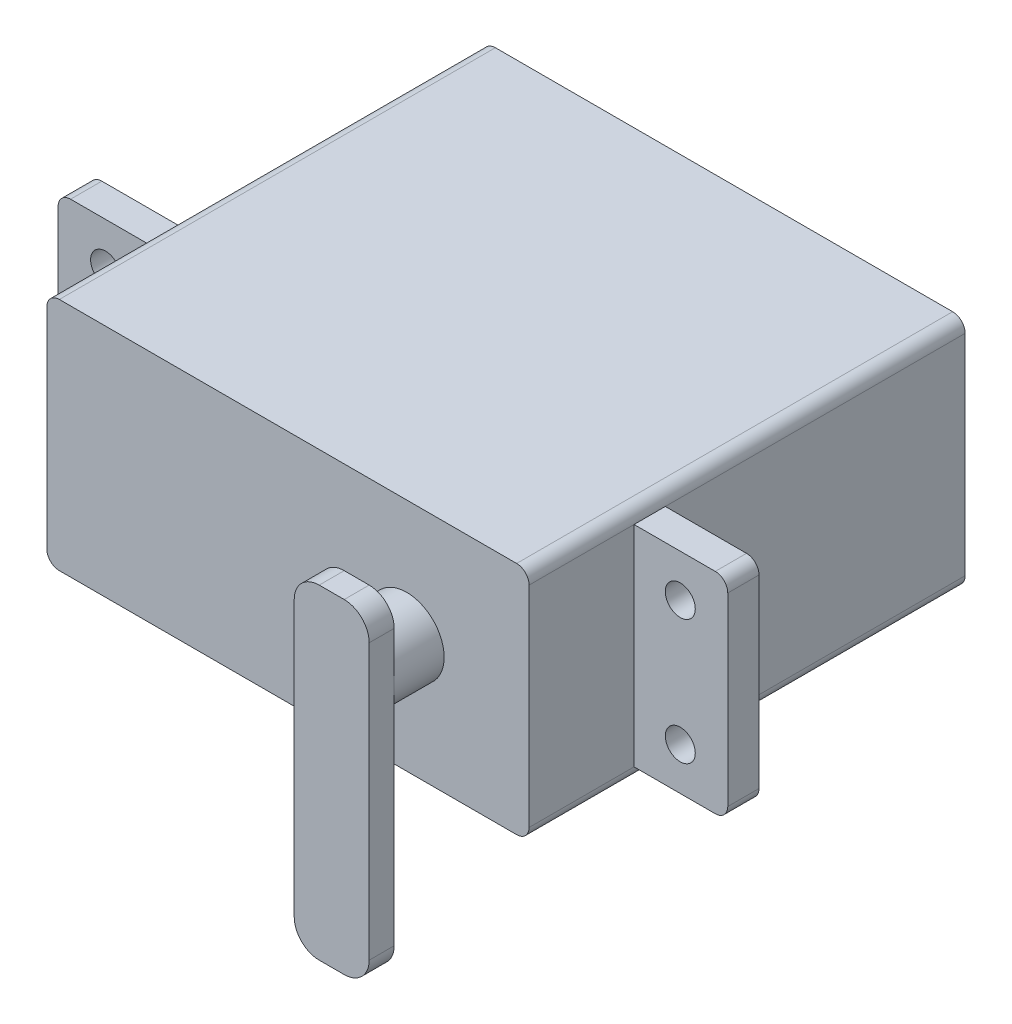
from build123d import *

# Parameters (mm, degrees)
BOSS_EXTRUDE1_DEPTH = 34.9
BOSS_EXTRUDE2_DEPTH = 2.5
SKETCH3_R           = 1.2
CUT_EXTRUDE1_DEPTH  = 2.5
SKETCH4_R           = 3
BOSS_EXTRUDE3_DEPTH = 4
BOSS_EXTRUDE4_DEPTH = 2


with BuildPart() as part:
    # Sketch1 → Boss-Extrude1 (new body)
    with BuildSketch(Plane.XY):
        with BuildLine():
            Line((-18.3, -9.4), (18.3, -9.4))
            ThreePointArc((18.3, -9.4), (19.007106781, -9.107106781), (19.3, -8.4))
            Line((19.3, -8.4), (19.3, 8.4))
            ThreePointArc((19.3, 8.4), (19.007106781, 9.107106781), (18.3, 9.4))
            Line((18.3, 9.4), (-18.3, 9.4))
            ThreePointArc((-18.3, 9.4), (-19.007106781, 9.107106781), (-19.3, 8.4))
            Line((-19.3, 8.4), (-19.3, -8.4))
            ThreePointArc((-19.3, -8.4), (-19.007106781, -9.107106781), (-18.3, -9.4))
        make_face()
    extrude(amount=BOSS_EXTRUDE1_DEPTH)

    # Sketch2 → Boss-Extrude2 (add)
    with BuildSketch(Plane.XY.offset(24)):
        with BuildLine():
            Line((-25.8, -8.4), (25.8, -8.4))
            ThreePointArc((25.8, -8.4), (26.507106781, -8.107106781), (26.8, -7.4))
            Line((26.8, -7.4), (26.8, 7.4))
            ThreePointArc((26.8, 7.4), (26.507106781, 8.107106781), (25.8, 8.4))
            Line((25.8, 8.4), (-25.8, 8.4))
            ThreePointArc((-25.8, 8.4), (-26.507106781, 8.107106781), (-26.8, 7.4))
            Line((-26.8, 7.4), (-26.8, -7.4))
            ThreePointArc((-26.8, -7.4), (-26.507106781, -8.107106781), (-25.8, -8.4))
        make_face()
    extrude(amount=BOSS_EXTRUDE2_DEPTH)

    # Sketch3 → Cut-Extrude1 (cut)
    with BuildSketch(Plane.XY.offset(24)):
        with Locations((23, 5)):
            Circle(SKETCH3_R)
        with Locations((23, -5)):
            Circle(SKETCH3_R)
        with Locations((-23, 5)):
            Circle(SKETCH3_R)
        with Locations((-23, -5)):
            Circle(SKETCH3_R)
    extrude(amount=CUT_EXTRUDE1_DEPTH, mode=Mode.SUBTRACT)

    # Sketch4 → Boss-Extrude3 (add)
    with BuildSketch(Plane.XY.offset(34.9)):
        with Locations((9.5, 0)):
            Circle(SKETCH4_R)
    extrude(amount=BOSS_EXTRUDE3_DEPTH)

    # Sketch5 → Boss-Extrude4 (add)
    with BuildSketch(Plane.XY.offset(38.9)):
        with BuildLine():
            Line((8.5, -20), (10.5, -20))
            ThreePointArc((10.5, -20), (11.914213562, -19.414213562), (12.5, -18))
            Line((12.5, -18), (12.5, 4))
            ThreePointArc((12.5, 4), (11.914213562, 5.414213562), (10.5, 6))
            Line((10.5, 6), (8.5, 6))
            ThreePointArc((8.5, 6), (7.085786438, 5.414213562), (6.5, 4))
            Line((6.5, 4), (6.5, -18))
            ThreePointArc((6.5, -18), (7.085786438, -19.414213562), (8.5, -20))
        make_face()
    extrude(amount=BOSS_EXTRUDE4_DEPTH)


solid = part.part
